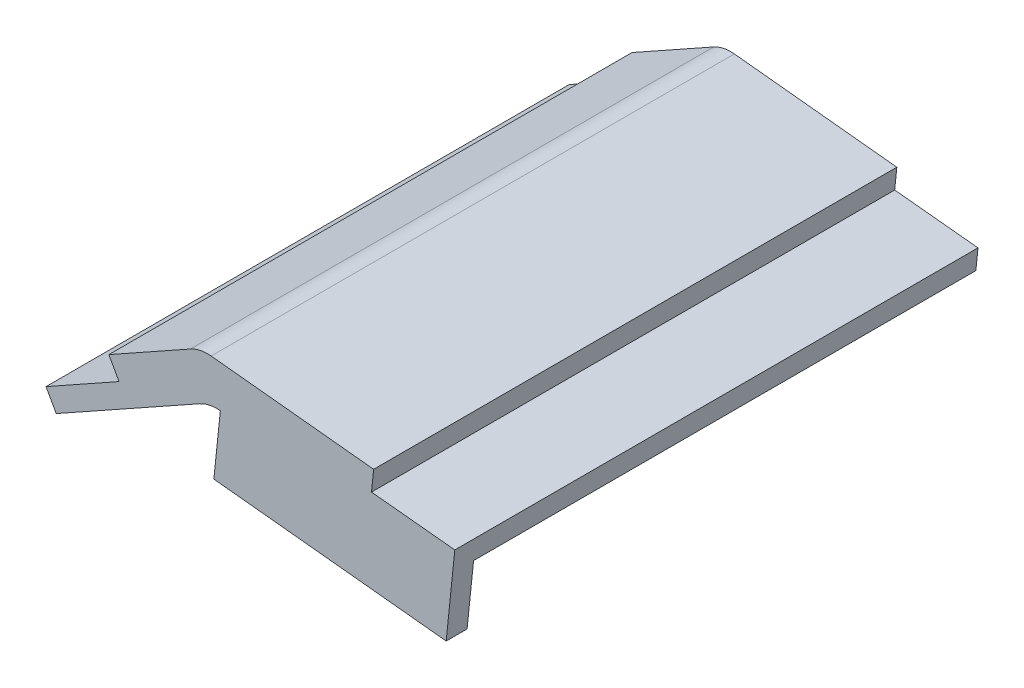
from build123d import *

# Parameters (mm, degrees)
BOSS_EXTRUDE1_DEPTH = 75
SKETCH2_W           = 33.479779341
SKETCH2_H           = 3
BOSS_EXTRUDE2_DEPTH = 9


with BuildPart() as part:
    # Sketch1 → Boss-Extrude1 (new body)
    with BuildSketch(Plane.XY):
        with BuildLine():
            Line((11.575975539, 13.62181128), (13.040589352, 11.003623667))
            Line((13.040589352, 11.003623667), (2.567838899, 5.145168413))
            Line((2.567838899, 5.145168413), (4.032452713, 2.5269808))
            Line((4.032452713, 2.5269808), (24.602620365, 14.033929934))
            ThreePointArc((24.602620365, 14.033929934), (26.034093135, 14.56730426), (27.559801463, 14.643570636))
            Line((27.559801463, 14.643570636), (60.860709888, 11.187398941))
            Line((60.860709888, 11.187398941), (61.170404733, 14.171370975))
            Line((61.170404733, 14.171370975), (49.231357904, 15.379328261))
            Line((49.231357904, 15.379328261), (49.533347225, 18.364089968))
            Line((49.533347225, 18.364089968), (26.242046455, 20.781403438))
            ThreePointArc((26.242046455, 20.781403438), (24.716338127, 20.705137062), (23.284865357, 20.171762736))
            Line((23.284865357, 20.171762736), (11.575975539, 13.62181128))
        make_face()
    extrude(amount=BOSS_EXTRUDE1_DEPTH)

    # Sketch2 → Boss-Extrude2 (add)
    with BuildSketch(Plane(origin=(1.797301431, 17.317360261, 0), x_dir=(0.9946573448357569, -0.10323161513936713, 0), z_dir=(-0.10323161513936711, -0.9946573448357567, 0))):
        with Locations((42.64076917, 73.5)):
            Rectangle(SKETCH2_W, SKETCH2_H)
    extrude(amount=BOSS_EXTRUDE2_DEPTH)


solid = part.part
